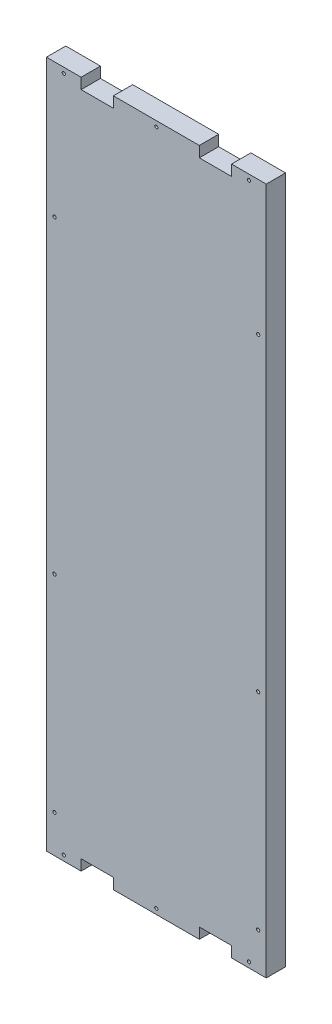
from build123d import *

# Parameters (mm, degrees)
SKETCH1_W                = 204.6
SKETCH1_H                = 640
BOSS_EXTRUDE1_DEPTH      = 18
SKETCH4_W                = 30
SKETCH4_H                = 10
CUT_EXTRUDE1_DEPTH       = 18
F_3_0_3_DIAMETER_HOLE3_D = 3
F_3_0_3_DIAMETER_HOLE5_D = 3


with BuildPart() as part:
    # Sketch1 → Boss-Extrude1 (new body)
    with BuildSketch(Plane.XY):
        with Locations((97, 283.5)):
            Rectangle(SKETCH1_W, SKETCH1_H)
    extrude(amount=BOSS_EXTRUDE1_DEPTH)

    # Sketch4 → Cut-Extrude1 (cut)
    with BuildSketch(Plane(origin=(0, 0, 0), x_dir=(-1, 0, 0), z_dir=(0, 0, -1))):
        with Locations((-42, -31.5)):
            Rectangle(SKETCH4_W, SKETCH4_H)
        with Locations((-152, -31.5)):
            Rectangle(SKETCH4_W, SKETCH4_H)
        with Locations((-42, 598.5)):
            Rectangle(SKETCH4_W, SKETCH4_H)
        with Locations((-152, 598.5)):
            Rectangle(SKETCH4_W, SKETCH4_H)
    extrude(amount=-CUT_EXTRUDE1_DEPTH, mode=Mode.SUBTRACT)

    # Ø3.0 (3) Diameter Hole3 (through all)
    with Locations(Plane(origin=(0, 0, 0), x_dir=(-1, 0, 0), z_dir=(0, 0, -1))):
        with Locations((-2.2, 190.5), (-2.2, -1.5), (-191.8, -1.5), (-191.8, 190.5), (-191.8, 478.5), (-2.2, 478.5)):
            Hole(F_3_0_3_DIAMETER_HOLE3_D / 2)

    # Ø3.0 (3) Diameter Hole5 (through all)
    with Locations(Plane(origin=(0, 0, 0), x_dir=(-1, 0, 0), z_dir=(0, 0, -1))):
        with Locations((238.536571684, 43.354956744), (-97, -31.5), (-183.15, -31.5), (-10.85, -31.5), (-10.85, 598.5), (-183.15, 598.5), (-97, 598.5)):
            Hole(F_3_0_3_DIAMETER_HOLE5_D / 2)


solid = part.part
